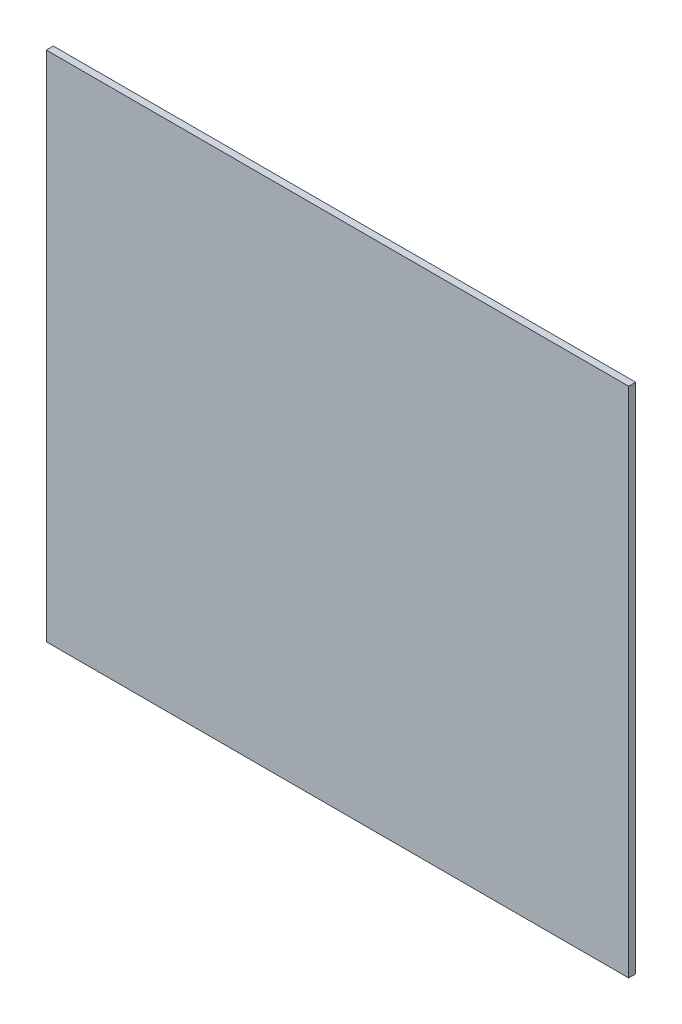
from build123d import *

# Parameters (mm, degrees)
SKETCH1_W           = 250
SKETCH1_H           = 220
BOSS_EXTRUDE1_DEPTH = 3
EXTRUDE_THIN1_DEPTH = 2


with BuildPart() as part:
    # Sketch1 → Boss-Extrude1 (new body)
    with BuildSketch(Plane.XY):
        with Locations((35.461157826, 79.854863969)):
            Rectangle(SKETCH1_W, SKETCH1_H)
    extrude(amount=BOSS_EXTRUDE1_DEPTH)

    # Sketch2 → Extrude-Thin1 (add)
    with BuildSketch(Plane(origin=(0, 129.854863969, 0), x_dir=(1, 0, 0), z_dir=(0, 1, 0))):
        with BuildLine():
            ThreePointArc((117.298879334, 7.909094463), (123.99586371, 15.093149798), (131.021373602, 8.230026488))
            Line((131.021373602, 8.230026488), (131.021373602, 0))
            Line((131.021373602, 0), (132.021373602, 0))
            Line((132.021373602, 0), (132.021373602, 8.230026488))
            ThreePointArc((132.021373602, 8.230026488), (123.972482809, 16.092876428), (116.299972667, 7.862345443))
            Line((116.299972667, 7.862345443), (117.298879334, 7.909094463))
        make_face()
        Polygon((117.483851661, 0), (117.291373602, 8.230026488), (116.291646972, 8.206645586), (116.484125031, -0.023380902), align=None)
    extrude(amount=EXTRUDE_THIN1_DEPTH)


solid = part.part
